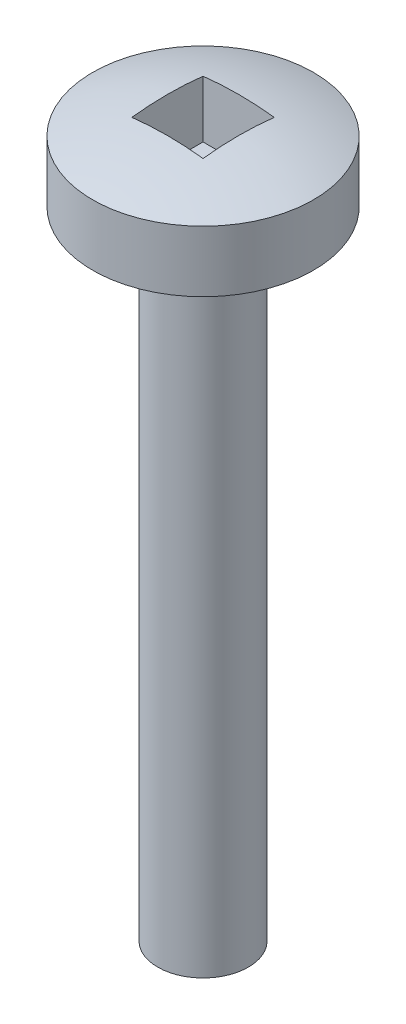
from build123d import *

# Parameters (mm, degrees)
SKETCH1_R            = 1.1303
THREADS_DEPTH        = 15.875
SKETCH2_R            = 2.7559
HEAD_DEPTH           = 1.524
HEADDOME_FACE_RADIUS = 2.7559
HEADDOME_HEIGHT      = 0.508
SKETCH3_W            = 1.778
SKETCH3_H            = 1.778
DRIVER_DEPTH         = 1.524


with BuildPart() as part:
    # Sketch1 → threads (new body)
    with BuildSketch(Plane(origin=(0, 0, 0), x_dir=(1, 0, 0), z_dir=(0, 1, 0))):
        with Locations(Location((0, 0, 0), (0, 0, 270))):
            Circle(SKETCH1_R)
    extrude(amount=-THREADS_DEPTH)

    # Sketch2 → Head (add)
    with BuildSketch(Plane(origin=(0, 0, 0), x_dir=(1, 0, 0), z_dir=(0, 1, 0))):
        with Locations(Location((0, 0, 0), (0, 0, 90))):
            Circle(SKETCH2_R)
    extrude(amount=HEAD_DEPTH)

    # HeadDome: a dome of height H over a round flat face of radius A is a cap of a sphere of radius (A * A + H * H) / (2 * H)
    headdome_r = (HEADDOME_FACE_RADIUS * HEADDOME_FACE_RADIUS + HEADDOME_HEIGHT * HEADDOME_HEIGHT) / (2 * HEADDOME_HEIGHT)
    headdome_base = Plane((0, 1.524, 0), z_dir=(0, 1, 0))
    with Locations(headdome_base.offset(HEADDOME_HEIGHT - headdome_r)):
        headdome_ball = Sphere(headdome_r, mode=Mode.PRIVATE)
    add(split(headdome_ball, bisect_by=headdome_base, keep=Keep.TOP, mode=Mode.PRIVATE))

    # Sketch3 → Driver (cut)
    with BuildSketch(Plane(origin=(0, 2.032, 0), x_dir=(1, 0, 0), z_dir=(0, 1, 0))):
        Rectangle(SKETCH3_W, SKETCH3_H)
    extrude(amount=-DRIVER_DEPTH, mode=Mode.SUBTRACT)


solid = part.part
